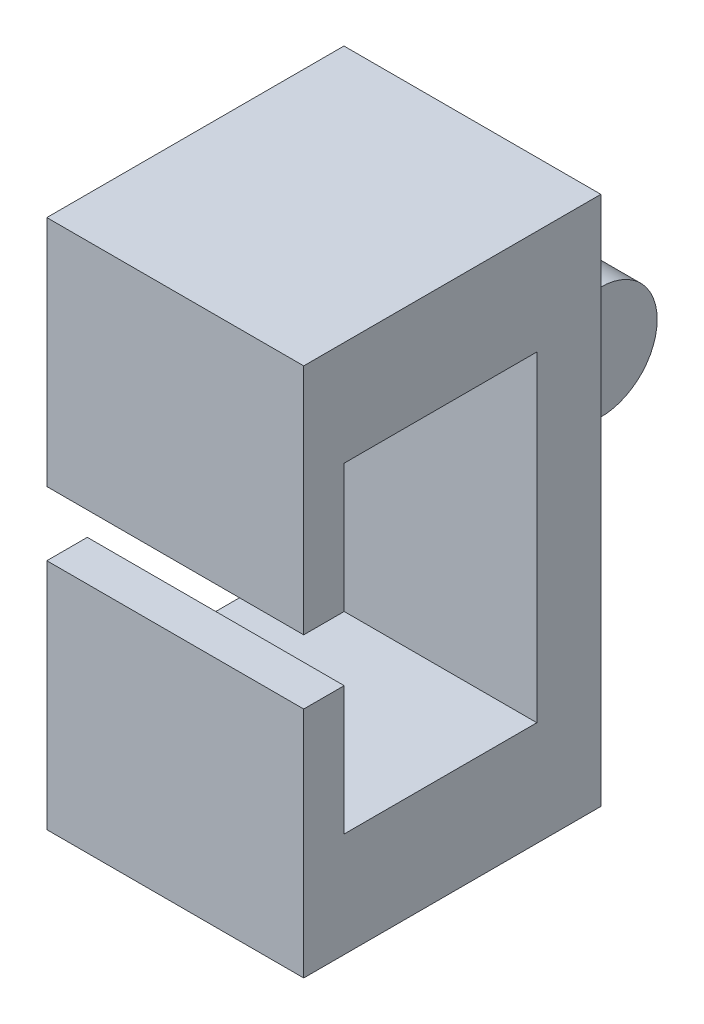
from build123d import *

# Parameters (mm, degrees)
SKETCH1_R           = 11.136121628
BOSS_EXTRUDE1_DEPTH = 25.4
SKETCH2_W           = 22.261321628
SKETCH2_H           = 25.4
BOSS_EXTRUDE2_DEPTH = 3.834635566
SKETCH3_W           = 63.5
SKETCH3_H           = 12.654490516
BOSS_EXTRUDE3_DEPTH = 50.8
SKETCH4_W           = 20.664696479
SKETCH4_H           = 50.754490516
BOSS_EXTRUDE4_DEPTH = 50.8
SKETCH5_W           = 46.064696479
SKETCH5_H           = 8.003402532
BOSS_EXTRUDE5_DEPTH = 50.8


with BuildPart() as part:
    # Sketch1 → Boss-Extrude1 (new body)
    with BuildSketch(Plane.YZ):
        with Locations(Location((0, 0, 0), (0, 0, 270))):
            Circle(SKETCH1_R)
    extrude(amount=BOSS_EXTRUDE1_DEPTH)

    # Sketch2 → Boss-Extrude2 (add)
    with BuildSketch(Plane(origin=(0, 0, 0), x_dir=(0, -1, 0), z_dir=(-1, 0, 0))):
        with Locations((-0.005460814, 12.7)):
            Rectangle(SKETCH2_W, SKETCH2_H)
    extrude(amount=-BOSS_EXTRUDE2_DEPTH)

    # Sketch3 → Boss-Extrude3 (add)
    with BuildSketch(Plane.YZ):
        with Locations((0, 31.727245258)):
            Rectangle(SKETCH3_W, SKETCH3_H)
    extrude(amount=BOSS_EXTRUDE3_DEPTH)

    # Sketch4 → Boss-Extrude4 (add)
    with BuildSketch(Plane.YZ):
        with Locations((-42.082348239, 50.777245258)):
            Rectangle(SKETCH4_W, SKETCH4_H)
        with Locations((42.082348239, 50.777245258)):
            Rectangle(SKETCH4_W, SKETCH4_H)
    extrude(amount=BOSS_EXTRUDE4_DEPTH)

    # Sketch5 → Boss-Extrude5 (add)
    with BuildSketch(Plane.YZ):
        with Locations((-29.38234824, 80.156191782)):
            Rectangle(SKETCH5_W, SKETCH5_H)
        with Locations((29.38234824, 80.156191782)):
            Rectangle(SKETCH5_W, SKETCH5_H)
    extrude(amount=BOSS_EXTRUDE5_DEPTH)


solid = part.part
